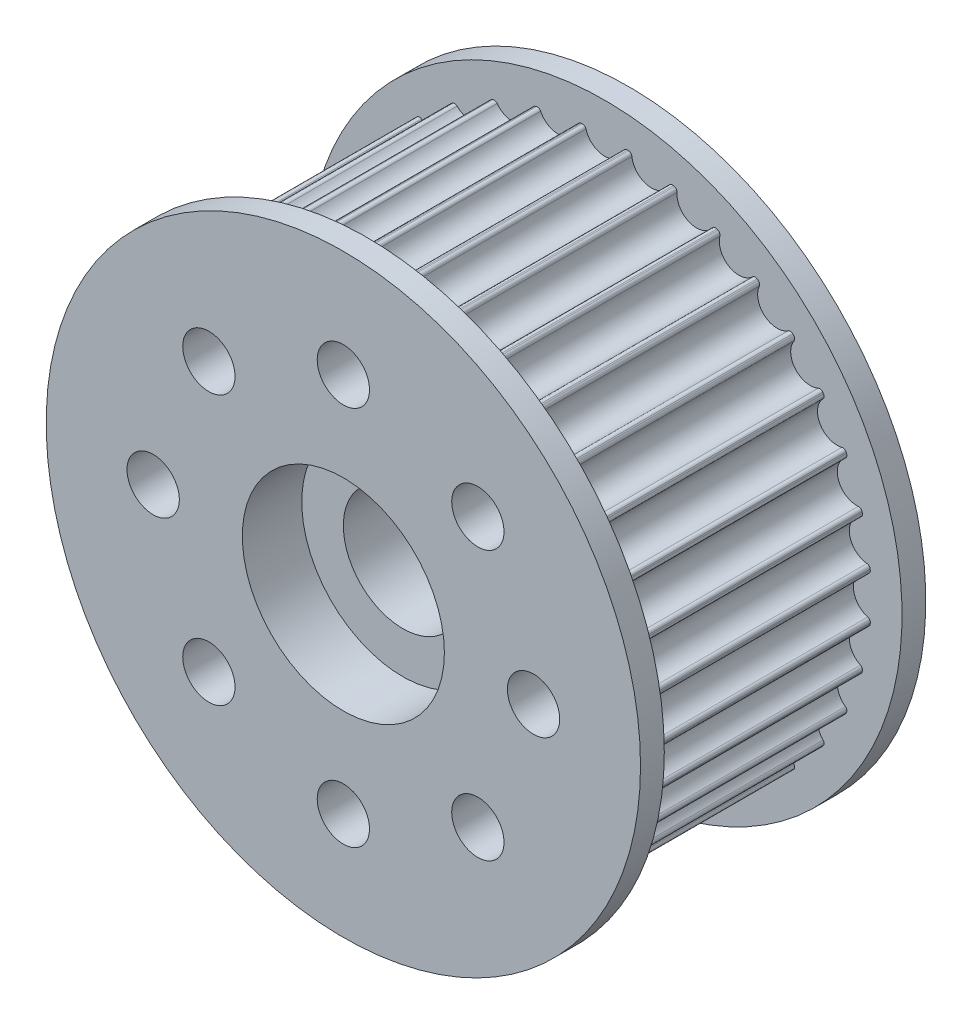
from build123d import *

# Parameters (mm, degrees)
BOSS_EXTRUDE1_DEPTH            = 5
FILLET1_R                      = 0.15
CIRPATTERN1_COUNT              = 36
FILLET1_OF_CIRPATTERN1_R       = 0.15
SKETCH2_R                      = 12.5
BOSS_EXTRUDE2_DEPTH            = 1
BOSS_EXTRUDE3_START            = 1
SKETCH3_R                      = 12.5
BOSS_EXTRUDE3_DEPTH            = 1
CBORE_FOR_M2_SHCS1_D           = 2.2
CBORE_FOR_M2_SHCS1_CBORE_D     = 4.4
CBORE_FOR_M2_SHCS1_CBORE_DEPTH = 2
SKETCH7_R                      = 4.25
CUT_EXTRUDE1_DEPTH             = 2.5
SKETCH8_R                      = 2.5
CUT_EXTRUDE2_DEPTH             = 5


with BuildPart() as part:
    # Sketch1 → Boss-Extrude1 (new, symmetric)
    with BuildSketch(Plane.XY):
        with BuildLine():
            Line((0, 0), (1.815491698, 10.296165058))
            ThreePointArc((1.815491698, 10.296165058), (1.314475399, 10.593332146), (1.134662937, 11.147401716))
            ThreePointArc((1.134662937, 11.147401716), (0.976580097, 11.162361592), (0.818301136, 11.175079787))
            ThreePointArc((0.818301136, 11.175079787), (0.545007259, 10.660651885), (0, 10.455))
            Line((0, 10.455), (0, 0))
        make_face()
    boss_extrude1 = extrude(amount=BOSS_EXTRUDE1_DEPTH, both=True)

    # Fillet1
    fillet1_edges = [part.edges().sort_by_distance(p)[0] for p in [
        (0.818301136, 11.175079787, 0),
        (1.134662937, 11.147401716, 0),
    ]]
    fillet(fillet1_edges, radius=FILLET1_R)

    # CirPattern1: Boss-Extrude1 ×36 about axis
    cirpattern1_axis = Axis((0, 0, 0), (0, 0, 1))
    for i in range(1, CIRPATTERN1_COUNT):
        add(boss_extrude1.rotate(cirpattern1_axis, i * 360 / CIRPATTERN1_COUNT))

    # Fillet1 of CirPattern1
    fillet1_of_cirpattern1_edges = [part.edges().sort_by_distance(p)[0] for p in [
        (-1.134662937, 11.147401716, 0),
        (-0.818301136, 11.175079787, 0),
        (-3.053150852, 10.781015485, 0),
        (-2.746401543, 10.863208714, 0),
        (-4.878870322, 10.087053553, 0),
        (-4.591053929, 10.221264541, 0),
        (-6.556347787, 9.086601604, 0),
        (-6.296209465, 9.268752417, 0),
        (-8.034613941, 7.810057862, 0),
        (-7.810057862, 8.034613941, 0),
        (-9.268752417, 6.296209465, 0),
        (-9.086601604, 6.556347787, 0),
        (-10.221264541, 4.591053929, 0),
        (-10.087053553, 4.878870322, 0),
        (-10.863208714, 2.746401543, 0),
        (-10.781015485, 3.053150852, 0),
        (-11.175079787, 0.818301136, 0),
        (-11.147401716, 1.134662937, 0),
        (-11.147401716, -1.134662937, 0),
        (-11.175079787, -0.818301136, 0),
        (-10.781015485, -3.053150852, 0),
        (-10.863208714, -2.746401543, 0),
        (-10.087053553, -4.878870322, 0),
        (-10.221264541, -4.591053929, 0),
        (-9.086601604, -6.556347787, 0),
        (-9.268752417, -6.296209465, 0),
        (-7.810057862, -8.034613941, 0),
        (-8.034613941, -7.810057862, 0),
        (-6.296209465, -9.268752417, 0),
        (-6.556347787, -9.086601604, 0),
        (-4.591053929, -10.221264541, 0),
        (-4.878870322, -10.087053553, 0),
        (-2.746401543, -10.863208714, 0),
        (-3.053150852, -10.781015485, 0),
        (-0.818301136, -11.175079787, 0),
        (-1.134662937, -11.147401716, 0),
        (1.134662937, -11.147401716, 0),
        (0.818301136, -11.175079787, 0),
        (3.053150852, -10.781015485, 0),
        (2.746401543, -10.863208714, 0),
        (4.878870322, -10.087053553, 0),
        (4.591053929, -10.221264541, 0),
        (6.556347787, -9.086601604, 0),
        (6.296209465, -9.268752417, 0),
        (8.034613941, -7.810057862, 0),
        (7.810057862, -8.034613941, 0),
        (9.268752417, -6.296209465, 0),
        (9.086601604, -6.556347787, 0),
        (10.221264541, -4.591053929, 0),
        (10.087053553, -4.878870322, 0),
        (10.863208714, -2.746401543, 0),
        (10.781015485, -3.053150852, 0),
        (11.175079787, -0.818301136, 0),
        (11.147401716, -1.134662937, 0),
        (11.147401716, 1.134662937, 0),
        (11.175079787, 0.818301136, 0),
        (10.781015485, 3.053150852, 0),
        (10.863208714, 2.746401543, 0),
        (10.087053553, 4.878870322, 0),
        (10.221264541, 4.591053929, 0),
        (9.086601604, 6.556347787, 0),
        (9.268752417, 6.296209465, 0),
        (7.810057862, 8.034613941, 0),
        (8.034613941, 7.810057862, 0),
        (6.296209465, 9.268752417, 0),
        (6.556347787, 9.086601604, 0),
        (4.591053929, 10.221264541, 0),
        (4.878870322, 10.087053553, 0),
        (2.746401543, 10.863208714, 0),
        (3.053150852, 10.781015485, 0),
    ]]
    fillet(fillet1_of_cirpattern1_edges, radius=FILLET1_OF_CIRPATTERN1_R)

    # Sketch2 → Boss-Extrude2 (add)
    with BuildSketch(Plane.XY.offset(5)):
        Circle(SKETCH2_R)
    extrude(amount=BOSS_EXTRUDE2_DEPTH)

    # Sketch3 → Boss-Extrude3 (add)
    with BuildSketch(Plane(origin=(0, 0, -5), x_dir=(-1, 0, 0), z_dir=(0, 0, -1)).offset(BOSS_EXTRUDE3_START)):
        with Locations(Location((0, 0, 0), (0, 0, 180))):
            Circle(SKETCH3_R)
    extrude(amount=-BOSS_EXTRUDE3_DEPTH)

    # CBORE for M2 SHCS1 (through all)
    with Locations(Plane(origin=(0, 0, -6), x_dir=(-1, 0, 0), z_dir=(0, 0, -1))):
        with Locations((0, 8), (5.656854249, 5.656854249), (8, 0), (5.656854249, -5.656854249), (0, -8), (-5.656854249, -5.656854249), (-8, 0), (-5.656854249, 5.656854249)):
            CounterBoreHole(CBORE_FOR_M2_SHCS1_D / 2, CBORE_FOR_M2_SHCS1_CBORE_D / 2, CBORE_FOR_M2_SHCS1_CBORE_DEPTH)

    # Sketch7 → Cut-Extrude1 (cut)
    with BuildSketch(Plane.XY.offset(6)):
        Circle(SKETCH7_R)
    extrude(amount=-CUT_EXTRUDE1_DEPTH, mode=Mode.SUBTRACT)

    # Sketch8 → Cut-Extrude2 (cut)
    with BuildSketch(Plane.XY.offset(6)):
        Circle(SKETCH8_R)
    extrude(amount=-CUT_EXTRUDE2_DEPTH, mode=Mode.SUBTRACT)


solid = part.part
